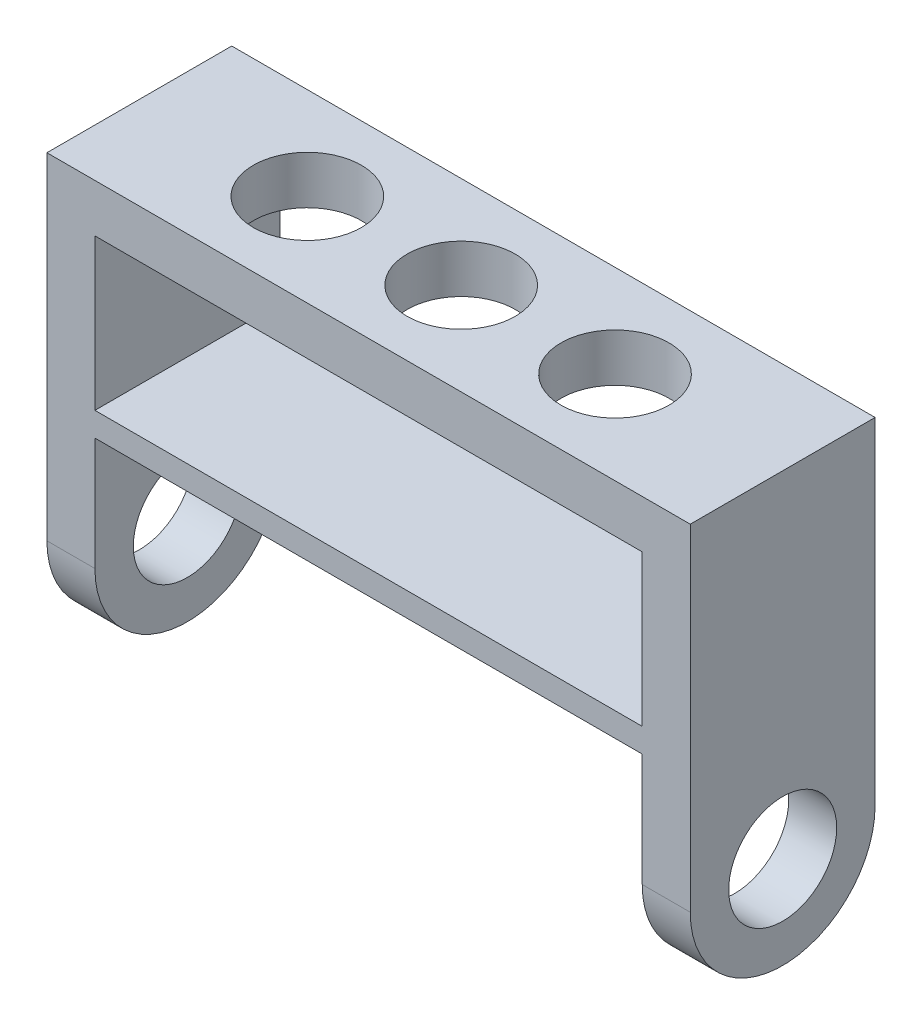
from build123d import *

# Parameters (mm, degrees)
SKETCH1_R           = 14.2875
BOSS_EXTRUDE1_DEPTH = 12.7
SKETCH2_W           = 48.895
SKETCH2_H           = 6.35
SKETCH2_H_2         = 12.7
BOSS_EXTRUDE2_DEPTH = 144.78
BOSS_EXTRUDE3_START = 12.7
SKETCH3_R           = 14.2875
BOSS_EXTRUDE3_DEPTH = 12.7
SKETCH4_R           = 14.2875
CUT_EXTRUDE1_DEPTH  = 25.654


with BuildPart() as part:
    # Sketch1 → Boss-Extrude1 (new body)
    with BuildSketch(Plane(origin=(0, 0, 0), x_dir=(0, 0, -1), z_dir=(1, 0, 0))):
        with BuildLine():
            Line((-24.4475, 0), (-24.4475, 88.9))
            Line((-24.4475, 88.9), (24.4475, 88.9))
            Line((24.4475, 88.9), (24.4475, 0))
            ThreePointArc((24.4475, 0), (0, -24.4475), (-24.4475, 0))
        make_face()
        Circle(SKETCH1_R, mode=Mode.SUBTRACT)
    extrude(amount=BOSS_EXTRUDE1_DEPTH)

    # Sketch2 → Boss-Extrude2 (add)
    with BuildSketch(Plane.ZY):
        with Locations((0, 33.056893832)):
            Rectangle(SKETCH2_W, SKETCH2_H)
        with Locations((0, 82.55)):
            Rectangle(SKETCH2_W, SKETCH2_H_2)
    extrude(amount=BOSS_EXTRUDE2_DEPTH)

    # Sketch3 → Boss-Extrude3 (add)
    with BuildSketch(Plane.ZY.offset(144.78).offset(BOSS_EXTRUDE3_START)):
        with BuildLine():
            Line((-24.4475, 0), (-24.4475, 88.9))
            Line((-24.4475, 88.9), (24.4475, 88.9))
            Line((24.4475, 88.9), (24.4475, 0))
            ThreePointArc((24.4475, 0), (0, -24.4475), (-24.4475, 0))
        make_face()
        with Locations(Location((0, 0, 0), (0, 0, 180))):
            Circle(SKETCH3_R, mode=Mode.SUBTRACT)
    extrude(amount=-BOSS_EXTRUDE3_DEPTH)

    # Sketch4 → Cut-Extrude1 (cut)
    with BuildSketch(Plane(origin=(0, 88.9, 0), x_dir=(1, 0, 0), z_dir=(0, 1, 0))):
        with Locations(Location((-113.03, 0, 0), (0, 0, 270))):
            Circle(SKETCH4_R)
        with Locations(Location((-72.3392, 0, 0), (0, 0, 270))):
            Circle(SKETCH4_R)
        with Locations(Location((-31.6484, 0, 0), (0, 0, 270))):
            Circle(SKETCH4_R)
    extrude(amount=-CUT_EXTRUDE1_DEPTH, mode=Mode.SUBTRACT)


solid = part.part
